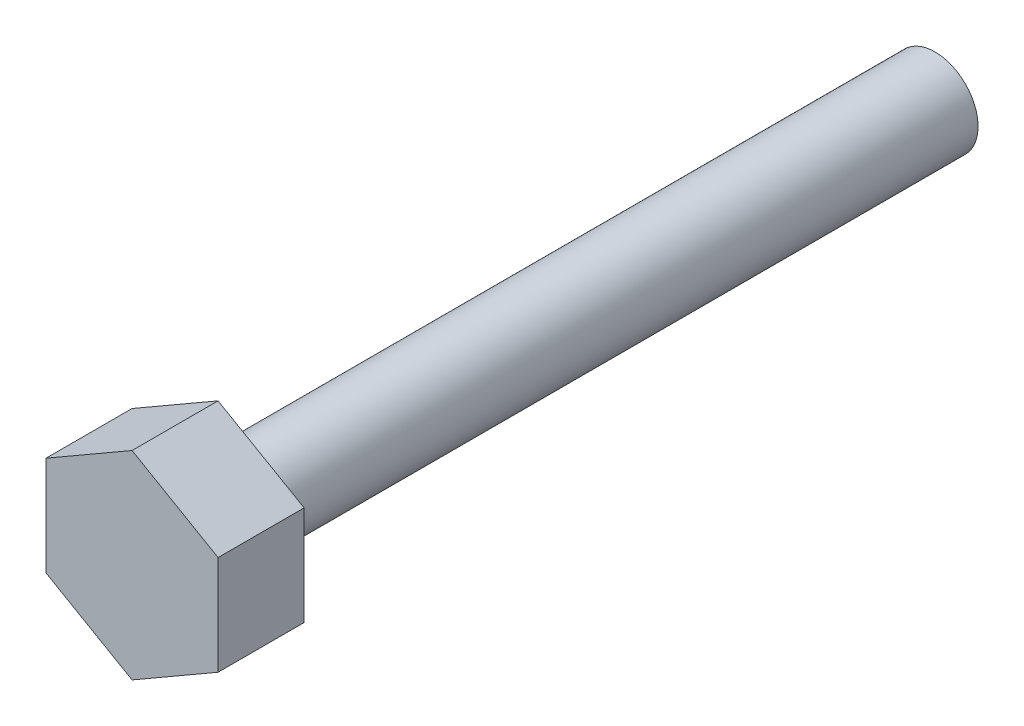
from build123d import *

# Parameters (mm, degrees)
BOSS_EXTRUDE2_DEPTH = 3
SKETCH5_R           = 3
BOSS_EXTRUDE3_DEPTH = 50


with BuildPart() as part:
    # Sketch4 → Boss-Extrude2 (new, symmetric)
    with BuildSketch(Plane.XY):
        Polygon((0, 6.92820323), (-6, 3.464101615), (-6, -3.464101615), (0, -6.92820323), (6, -3.464101615), (6, 3.464101615), align=None)
    extrude(amount=BOSS_EXTRUDE2_DEPTH, both=True)

    # Sketch5 → Boss-Extrude3 (add)
    with BuildSketch(Plane(origin=(0, 0, -3), x_dir=(-1, 0, 0), z_dir=(0, 0, -1))):
        Circle(SKETCH5_R)
    extrude(amount=BOSS_EXTRUDE3_DEPTH)


solid = part.part
